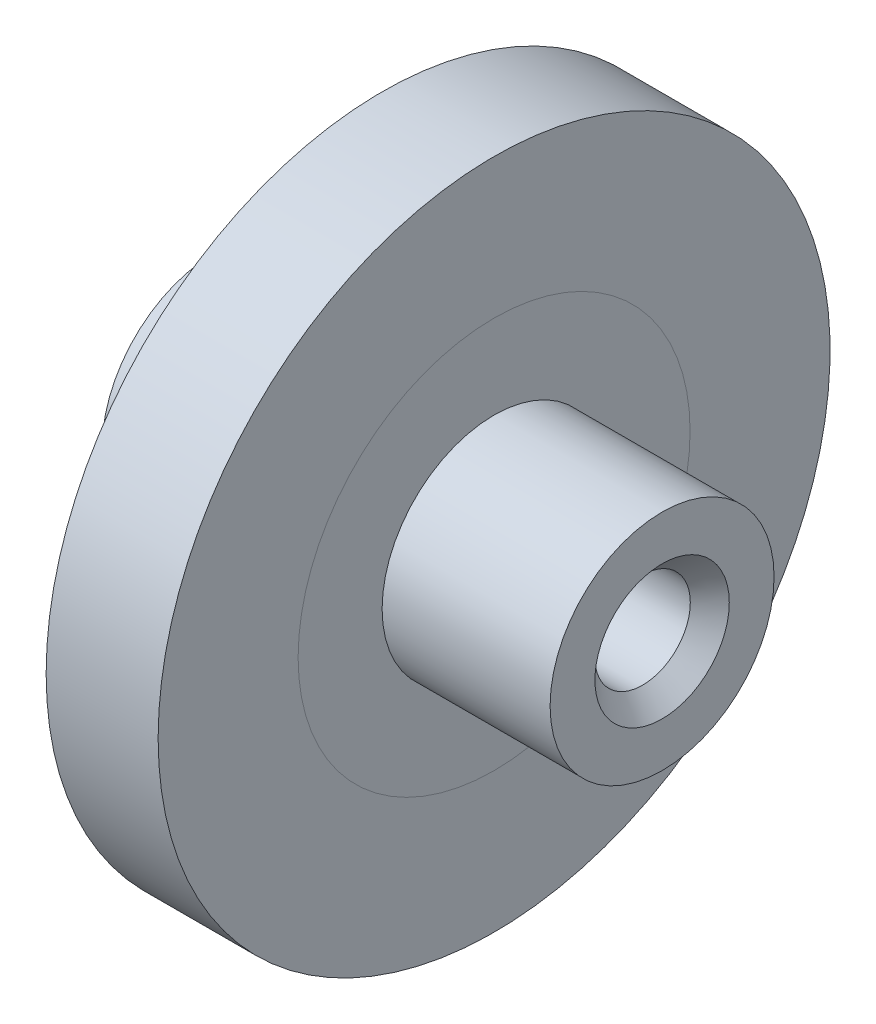
from build123d import *

# Parameters (mm, degrees)
SKETCH1_W   = 9.525
SKETCH1_H   = 6.35
SKETCH1_W_2 = 3.175
SKETCH1_H_2 = 19.05


with BuildPart() as part:
    # Sketch1 → Revolve1 (revolve)
    with BuildSketch(Plane.XY, mode=Mode.PRIVATE) as revolve1_sk:
        with Locations((7.9375, 3.175)):
            Rectangle(SKETCH1_W, SKETCH1_H)
        with Locations((1.5875, 9.525)):
            Rectangle(SKETCH1_W_2, SKETCH1_H_2)
    revolve1 = revolve(revolve1_sk.sketch.rotate(Axis((0, 0, 0), (1, 0, 0)), 90), axis=Axis((0, 0, 0), (1, 0, 0)))

    # Mirror1: Revolve1 across Right Plane
    add(revolve1.mirror(Plane(origin=(0, 0, 0), x_dir=(0, 0, -1), z_dir=(1, 0, 0))))

    # Sketch3 → 1/4-28 Tapped Hole1 (revolve, cut)
    with BuildSketch(Plane(origin=(12.7, 0, 0), x_dir=(0, 0, -1), z_dir=(0, 1, 0))):
        Polygon((0, 0), (0, 25.4), (3.3401, 25.4), (2.7051, 24.765), (2.7051, 1.1049), (3.81, 0), align=None)
    revolve(axis=Axis((19.05, 0, 0), (-1, 0, 0)), mode=Mode.SUBTRACT)


solid = part.part
